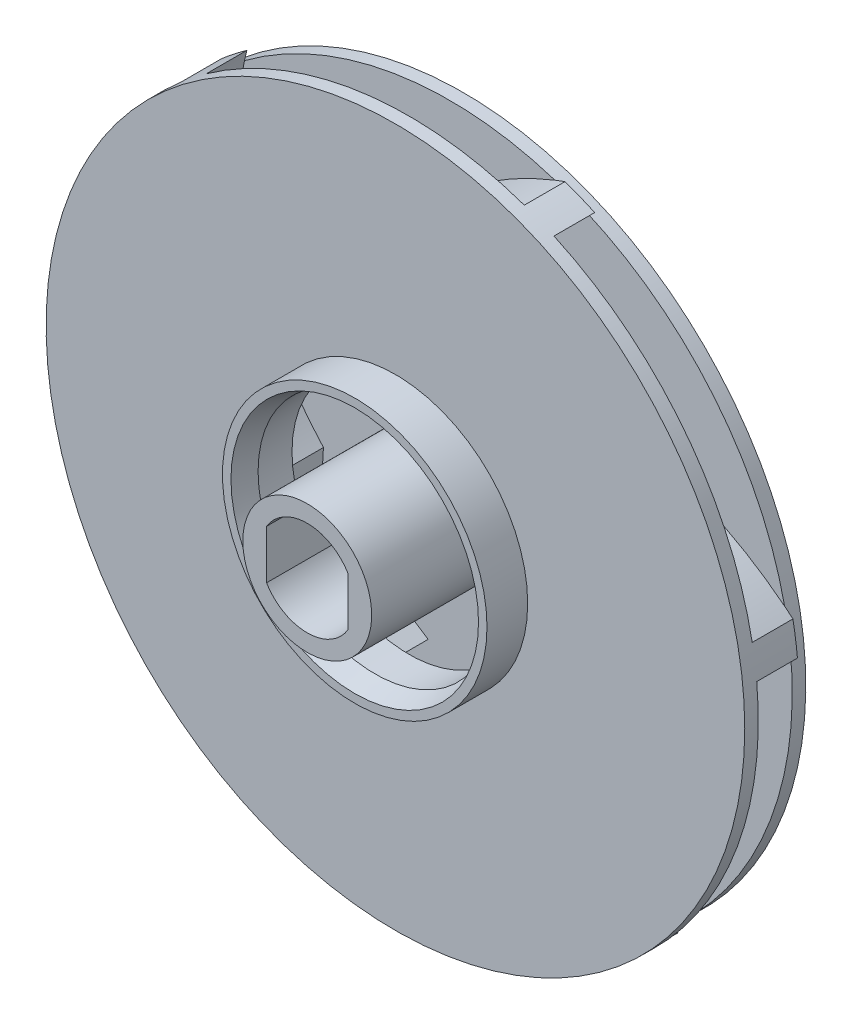
from build123d import *

# Parameters (mm, degrees)
SKETCH1_R           = 51.5
BOSS_EXTRUDE1_DEPTH = 2
SKETCH2_R           = 17.25
CUT_EXTRUDE1_DEPTH  = 2
BOSS_EXTRUDE3_START = 6
BOSS_EXTRUDE3_DEPTH = 6
CIRPATTERN2_COUNT   = 6
BOSS_EXTRUDE4_START = 6
SKETCH5_R           = 19.5
SKETCH5_R_2         = 17.25
BOSS_EXTRUDE4_DEPTH = 6
CHAMFER1_SIZE       = 1
CHAMFER1_SIZE2      = 3
BOSS_EXTRUDE5_START = 2
SKETCH6_R           = 51.5
BOSS_EXTRUDE5_DEPTH = 2
SKETCH7_R           = 19.5
BOSS_EXTRUDE6_DEPTH = 5
SKETCH8_R           = 9.5
BOSS_EXTRUDE7_DEPTH = 28
CUT_EXTRUDE2_DEPTH  = 79.028840822
SKETCH10_R          = 7.5
CUT_EXTRUDE3_DEPTH  = 2
SKETCH11_R          = 15.5
SKETCH11_R_2        = 12.5
CUT_EXTRUDE4_DEPTH  = 3
SKETCH12_R          = 57.826662367
SKETCH12_R_2        = 50.5
CUT_EXTRUDE5_DEPTH  = 50


with BuildPart() as part:
    # Sketch1 → Boss-Extrude1 (new body)
    with BuildSketch(Plane.XY):
        Circle(SKETCH1_R)
    extrude(amount=BOSS_EXTRUDE1_DEPTH)

    # Sketch2 → Cut-Extrude1 (cut)
    with BuildSketch(Plane.XY.offset(2)):
        Circle(SKETCH2_R)
    extrude(amount=-CUT_EXTRUDE1_DEPTH, mode=Mode.SUBTRACT)

    # Sketch4 → Boss-Extrude3 (add)
    with BuildSketch(Plane(origin=(0, 0, 0), x_dir=(-1, 0, 0), z_dir=(0, 0, -1)).offset(BOSS_EXTRUDE3_START)):
        with BuildLine():
            Line((15.659504395, 12.715698759), (12.020980416, 14.553474713))
            ThreePointArc((12.020980416, 14.553474713), (-0.569243838, 34.9508437), (-21.374545455, 46.854869615))
            ThreePointArc((-21.374545455, 46.854869615), (-19.207405538, 47.784156082), (-17, 48.613269793))
            ThreePointArc((-17, 48.613269793), (3.810982012, 34.741493963), (15.659504395, 12.715698759))
        make_face()
    boss_extrude3 = extrude(amount=-BOSS_EXTRUDE3_DEPTH)

    # CirPattern2: Boss-Extrude3 ×6 about axis
    cirpattern2_axis = Axis((0, 0, 0), (0, 0, 1))
    for i in range(1, CIRPATTERN2_COUNT):
        add(boss_extrude3.rotate(cirpattern2_axis, i * 360 / CIRPATTERN2_COUNT))

    # Sketch5 → Boss-Extrude4 (add)
    with BuildSketch(Plane.XY.offset(2).offset(BOSS_EXTRUDE4_START)):
        Circle(SKETCH5_R)
        Circle(SKETCH5_R_2, mode=Mode.SUBTRACT)
    extrude(amount=-BOSS_EXTRUDE4_DEPTH)

    # Chamfer1
    chamfer1_edges = [part.edges().sort_by_distance(p)[0] for p in [
        (-17.25, 0, 8),
    ]]
    chamfer1_side = [part.faces().sort_by_distance(p)[0] for p in [
        (-18.948456711, 0, 8),
    ]]
    chamfer(chamfer1_edges, length=CHAMFER1_SIZE, length2=CHAMFER1_SIZE2, reference=chamfer1_side[0])

    # Sketch6 → Boss-Extrude5 (add)
    with BuildSketch(Plane(origin=(0, 0, -6), x_dir=(-1, 0, 0), z_dir=(0, 0, -1)).offset(BOSS_EXTRUDE5_START)):
        Circle(SKETCH6_R)
    extrude(amount=-BOSS_EXTRUDE5_DEPTH)

    # Sketch7 → Boss-Extrude6 (add)
    with BuildSketch(Plane(origin=(0, 0, -8), x_dir=(-1, 0, 0), z_dir=(0, 0, -1))):
        with Locations(Location((0, 0, 0), (0, 0, 180))):
            Circle(SKETCH7_R)
    extrude(amount=BOSS_EXTRUDE6_DEPTH)

    # Sketch8 → Boss-Extrude7 (add)
    with BuildSketch(Plane(origin=(0, 0, -13), x_dir=(-1, 0, 0), z_dir=(0, 0, -1))):
        Circle(SKETCH8_R)
    extrude(amount=-BOSS_EXTRUDE7_DEPTH)

    # Sketch9 → Cut-Extrude2 (cut, through all)
    with BuildSketch(Plane.XY.offset(15)):
        with BuildLine():
            Line((6, 0), (6, 3.605551275))
            ThreePointArc((6, 3.605551275), (0, 7), (-6, 3.605551275))
            Line((-6, 3.605551275), (-6, 0))
            Line((-6, 0), (-6, -3.605551275))
            ThreePointArc((-6, -3.605551275), (0, -7), (6, -3.605551275))
            Line((6, -3.605551275), (6, 0))
        make_face()
    extrude(amount=-CUT_EXTRUDE2_DEPTH, mode=Mode.SUBTRACT)

    # Sketch10 → Cut-Extrude3 (cut)
    with BuildSketch(Plane(origin=(0, 0, -13), x_dir=(-1, 0, 0), z_dir=(0, 0, -1))):
        Circle(SKETCH10_R)
    extrude(amount=-CUT_EXTRUDE3_DEPTH, mode=Mode.SUBTRACT)

    # Sketch11 → Cut-Extrude4 (cut)
    with BuildSketch(Plane(origin=(0, 0, -13), x_dir=(-1, 0, 0), z_dir=(0, 0, -1))):
        Circle(SKETCH11_R)
        Circle(SKETCH11_R_2, mode=Mode.SUBTRACT)
    extrude(amount=-CUT_EXTRUDE4_DEPTH, mode=Mode.SUBTRACT)

    # Sketch12 → Cut-Extrude5 (cut)
    with BuildSketch(Plane.XY.offset(-6)):
        Circle(SKETCH12_R)
        with Locations(Location((0, 0, 0), (0, 0, 6.803897331))):
            Circle(SKETCH12_R_2, mode=Mode.SUBTRACT)
    extrude(amount=-CUT_EXTRUDE5_DEPTH, mode=Mode.SUBTRACT)


solid = part.part
